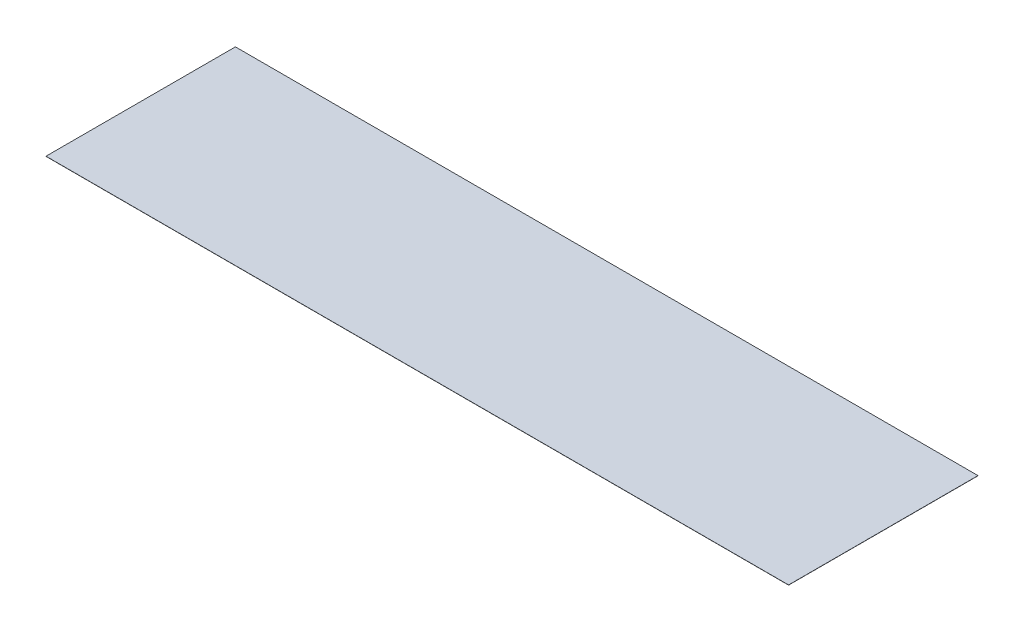
from build123d import *

# Parameters (mm, degrees)
SKETCH1_W     = 321.5
SKETCH1_H     = 82
COATING_DEPTH = 0.0762


with BuildPart() as part:
    # Sketch1 → Coating (new body)
    with BuildSketch(Plane(origin=(0, 0, 0), x_dir=(1, 0, 0), z_dir=(0, 1, 0))):
        with Locations((160.75, 41)):
            Rectangle(SKETCH1_W, SKETCH1_H)
    extrude(amount=COATING_DEPTH)


solid = part.part
